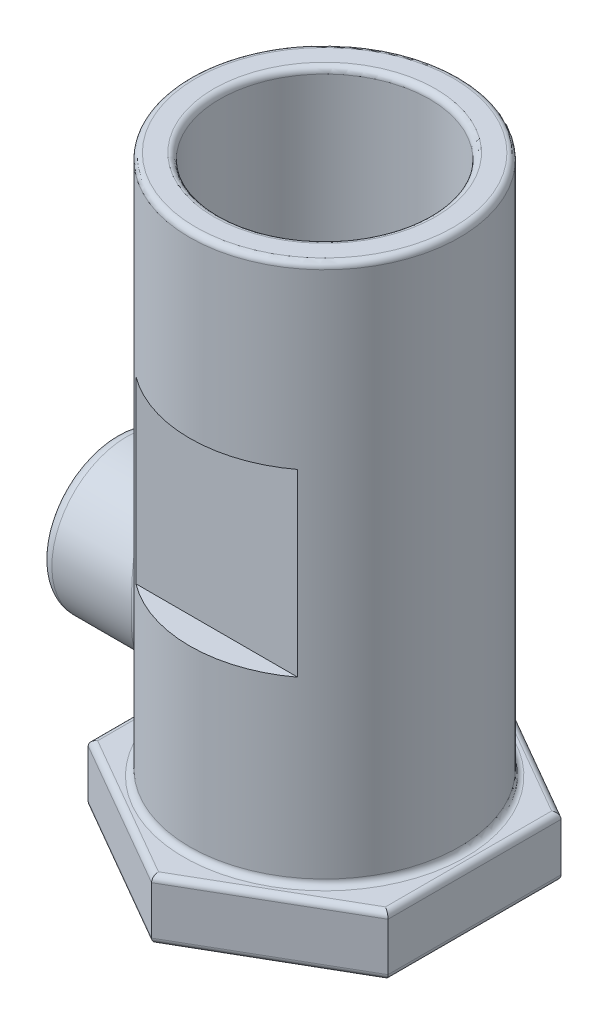
from build123d import *

# Parameters (mm, degrees)
SKETCH5_R                       = 11.25
SKETCH5_R_2                     = 8.75
BOSS_EXTRUDE3_DEPTH             = 50
SKETCH6_R                       = 8.75
BOSS_EXTRUDE4_DEPTH             = 5
FILLET1_R                       = 0.5
BOSS_EXTRUDE6_REACH             = 62.069
BOSS_EXTRUDE6_END_RADIUS        = 11.25
SKETCH16_R                      = 6.25
CBORE_FOR_M4_SBHCS1_D           = 3
CBORE_FOR_M4_SBHCS1_DEPTH       = 10
CBORE_FOR_M4_SBHCS1_CBORE_D     = 8.6
CBORE_FOR_M4_SBHCS1_CBORE_DEPTH = 2.2
CBORE_FOR_M4_SBHCS1_TIP         = 0.901290929
CUT_EXTRUDE1_DEPTH              = 55.90522149
CUT_EXTRUDE1_DEPTH_BACK         = 55.90522149
SKETCH11_W                      = 2.25
SKETCH11_H                      = 15
M4X0_7_TAPPED_HOLE1_D           = 3.3
M4X0_7_TAPPED_HOLE1_DEPTH       = 10.1
M4X0_7_TAPPED_HOLE1_TIP         = 0.991420021
FILLET3_R                       = 1


with BuildPart() as part:
    # Sketch5 → Boss-Extrude3 (new body)
    with BuildSketch(Plane(origin=(0, 0, 0), x_dir=(1, 0, 0), z_dir=(0, 1, 0))):
        with Locations(Location((0, 0, 0), (0, 0, 270))):
            Circle(SKETCH5_R)
        with Locations(Location((0, 0, 0), (0, 0, 270))):
            Circle(SKETCH5_R_2, mode=Mode.SUBTRACT)
    extrude(amount=BOSS_EXTRUDE3_DEPTH)

    # Sketch6 → Boss-Extrude4 (add)
    with BuildSketch(Plane.XZ):
        Polygon((0, 14.43375673), (-12.5, 7.216878365), (-12.5, -7.216878365), (0, -14.43375673), (12.5, -7.216878365), (12.5, 7.216878365), align=None)
        with Locations(Location((0, 0, 0), (0, 0, 90))):
            Circle(SKETCH6_R, mode=Mode.SUBTRACT)
    extrude(amount=-BOSS_EXTRUDE4_DEPTH)

    # Fillet1
    fillet1_edges = [part.edges().sort_by_distance(p)[0] for p in [
        (0, 5, -11.25),
        (6.25, 0, 10.825317547),
        (-6.25, 0, 10.825317547),
        (-12.5, 0, 0),
        (-6.25, 0, -10.825317547),
        (6.25, 0, -10.825317547),
        (12.5, 0, 0),
        (6.25, 5, 10.825317547),
        (12.5, 5, 0),
        (6.25, 5, -10.825317547),
        (-6.25, 5, -10.825317547),
        (-12.5, 5, 0),
        (-6.25, 5, 10.825317547),
        (0, 50, -11.25),
        (0, 50, -8.75),
    ]]
    fillet(fillet1_edges, radius=FILLET1_R)

    # Boss-Extrude6: up to this cylinder (the profile starts outside it)
    boss_extrude6_end = Plane(origin=(0, 15, 0), z_dir=(0, -1, 0)) * Cylinder(BOSS_EXTRUDE6_END_RADIUS, 147.638, mode=Mode.PRIVATE)
    # Sketch16 → Boss-Extrude6 (add, up to the surface)
    with BuildSketch(Plane(origin=(-17.5, 0, 0), x_dir=(0, 0, -1), z_dir=(1, 0, 0)), mode=Mode.PRIVATE) as boss_extrude6_sk1:
        with Locations(Location((0, 15, 0), (0, 0, 180))):
            Circle(SKETCH16_R)
    boss_extrude6_tool1 = extrude(boss_extrude6_sk1.sketch, amount=BOSS_EXTRUDE6_REACH, mode=Mode.PRIVATE) - boss_extrude6_end
    add(boss_extrude6_tool1.solids().sort_by_distance((-17.5, 15, 0))[0])

    # CBORE for M4 SBHCS1
    with Locations(Plane.ZY.offset(17.5)):
        with Locations((0, 15)):
            CounterBoreHole(CBORE_FOR_M4_SBHCS1_D / 2, CBORE_FOR_M4_SBHCS1_CBORE_D / 2, CBORE_FOR_M4_SBHCS1_CBORE_DEPTH, depth=CBORE_FOR_M4_SBHCS1_DEPTH)
            with Locations((0, 0, -(CBORE_FOR_M4_SBHCS1_DEPTH + CBORE_FOR_M4_SBHCS1_TIP / 2))):  # 118° drill point
                Cone(0, CBORE_FOR_M4_SBHCS1_D / 2, CBORE_FOR_M4_SBHCS1_TIP, mode=Mode.SUBTRACT)

    # Sketch11 → Cut-Extrude1 (cut, two sides: drawn at the far end of the back side and taken through both)
    with BuildSketch(Plane(origin=(0, 0, 0), x_dir=(0, 0, -1), z_dir=(1, 0, 0)).offset(-CUT_EXTRUDE1_DEPTH_BACK)):
        with Locations((-10.125, 27.5)):
            Rectangle(SKETCH11_W, SKETCH11_H)
        with Locations((10.125, 27.5)):
            Rectangle(SKETCH11_W, SKETCH11_H)
    extrude(amount=CUT_EXTRUDE1_DEPTH + CUT_EXTRUDE1_DEPTH_BACK, mode=Mode.SUBTRACT)

    # M4x0.7 Tapped Hole1
    with Locations(Plane.ZY.offset(15.3)):
        with Locations((0, 15)):
            Hole(M4X0_7_TAPPED_HOLE1_D / 2, depth=M4X0_7_TAPPED_HOLE1_DEPTH)
            with Locations((0, 0, -(M4X0_7_TAPPED_HOLE1_DEPTH + M4X0_7_TAPPED_HOLE1_TIP / 2))):  # 118° drill point
                Cone(0, M4X0_7_TAPPED_HOLE1_D / 2, M4X0_7_TAPPED_HOLE1_TIP, mode=Mode.SUBTRACT)

    # Fillet3
    fillet3_edges = [part.edges().sort_by_distance(p)[0] for p in [
        (-9.354143467, 15, -6.25),
        (-17.5, 15, -6.25),
    ]]
    fillet(fillet3_edges, radius=FILLET3_R)


solid = part.part
